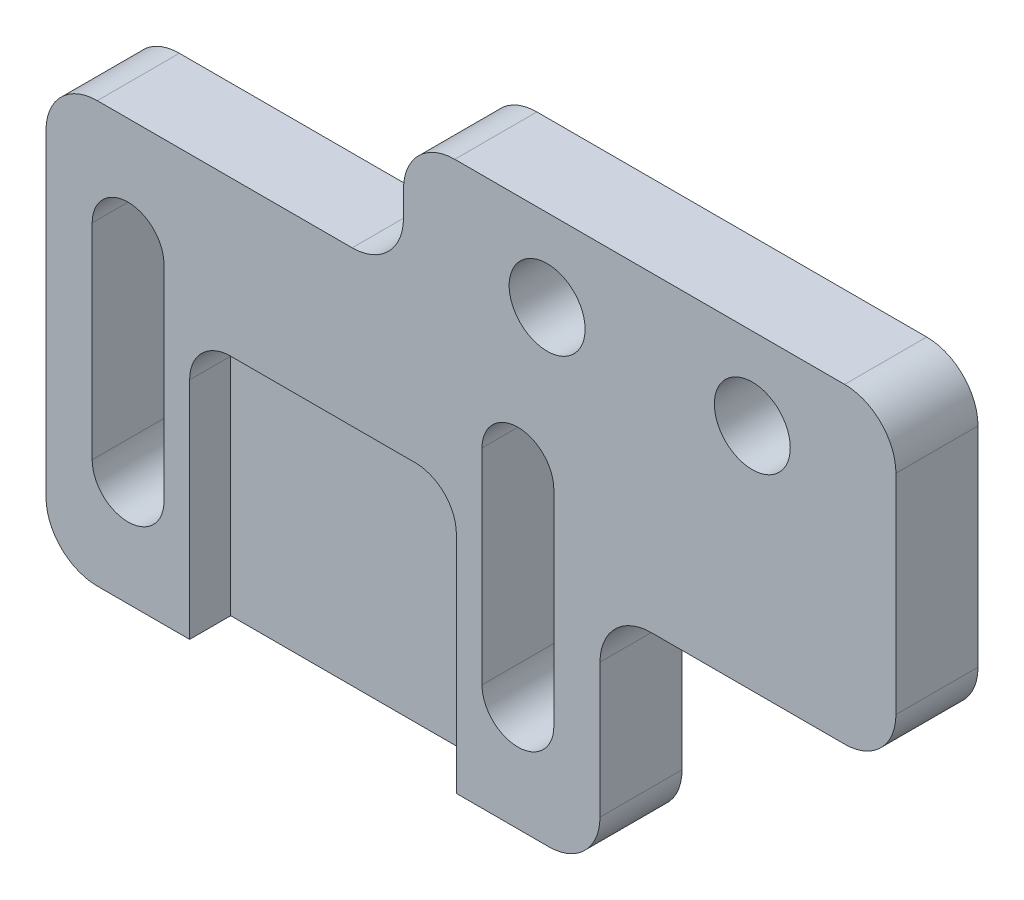
from build123d import *

# Parameters (mm, degrees)
SKETCH1_R           = 1.85
BOSS_EXTRUDE1_DEPTH = 4
FILLET1_R           = 2.5
SKETCH2_W           = 13
SKETCH2_H           = 20
CUT_EXTRUDE1_DEPTH  = 2
FILLET2_R           = 2


with BuildPart() as part:
    # Sketch1 → Boss-Extrude1 (new body)
    with BuildSketch(Plane.XY):
        Polygon((-12, 19.974398687), (12, 19.974398687), (12, 4.787936134), (-2.422914658, 4.787936134), (-2.422914658, -6.752077686), (-29.422914658, -6.752077686), (-29.422914658, 13.7384821), (-12, 13.7384821), align=None)
        with Locations((-5, 15.974398687)):
            Circle(SKETCH1_R, mode=Mode.SUBTRACT)
        with Locations((5, 15.974398687)):
            Circle(SKETCH1_R, mode=Mode.SUBTRACT)
        with BuildLine():
            Line((-4.672914658, 8.454123535), (-4.672914658, -1.545876465))
            ThreePointArc((-4.672914658, -1.545876465), (-6.422914658, -3.295876465), (-8.172914658, -1.545876465))
            Line((-8.172914658, -1.545876465), (-8.172914658, 8.454123535))
            ThreePointArc((-8.172914658, 8.454123535), (-6.422914658, 10.204123534), (-4.672914658, 8.454123535))
        make_face(mode=Mode.SUBTRACT)
        with BuildLine():
            Line((-23.672914658, 8.454123535), (-23.672914658, -1.545876465))
            ThreePointArc((-23.672914658, -1.545876465), (-25.422914658, -3.295876465), (-27.172914658, -1.545876465))
            Line((-27.172914658, -1.545876465), (-27.172914658, 8.454123535))
            ThreePointArc((-27.172914658, 8.454123535), (-25.422914658, 10.204123534), (-23.672914658, 8.454123535))
        make_face(mode=Mode.SUBTRACT)
    extrude(amount=BOSS_EXTRUDE1_DEPTH)

    # Fillet1
    fillet1_edges = [part.edges().sort_by_distance(p)[0] for p in [
        (-12, 19.974398687, 2),
        (12, 19.974398687, 2),
        (12, 4.787936134, 2),
        (-2.422914658, 4.787936134, 2),
        (-2.422914658, -6.752077686, 2),
        (-29.422914658, -6.752077686, 2),
        (-29.422914658, 13.7384821, 2),
        (-12, 13.7384821, 2),
    ]]
    fillet(fillet1_edges, radius=FILLET1_R)

    # Sketch2 → Cut-Extrude1 (cut)
    with BuildSketch(Plane.XY.offset(4)):
        with Locations((-15.922914658, -3.795876465)):
            Rectangle(SKETCH2_W, SKETCH2_H)
    extrude(amount=-CUT_EXTRUDE1_DEPTH, mode=Mode.SUBTRACT)

    # Fillet2
    fillet2_edges = [part.edges().sort_by_distance(p)[0] for p in [
        (-9.422914658, 6.204123535, 3),
        (-22.422914658, 6.204123535, 3),
    ]]
    fillet(fillet2_edges, radius=FILLET2_R)


solid = part.part
